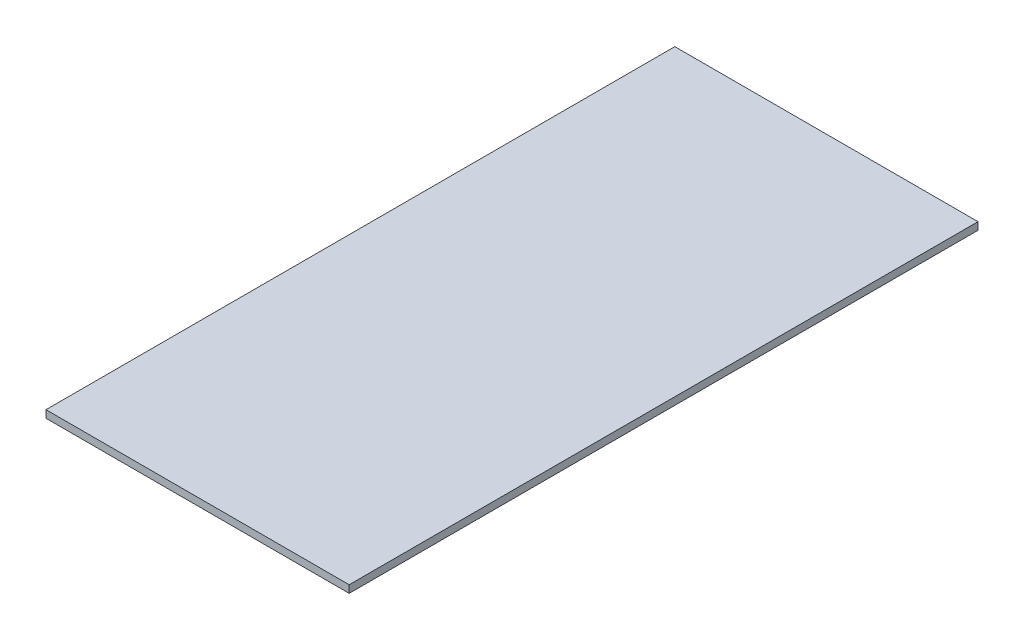
from build123d import *

# Parameters (mm, degrees)
SKETCH1_W           = 514.35
SKETCH1_H           = 1066.8
BOSS_EXTRUDE1_DEPTH = 12.7


with BuildPart() as part:
    # Sketch1 → Boss-Extrude1 (new body)
    with BuildSketch(Plane(origin=(0, 0, 0), x_dir=(1, 0, 0), z_dir=(0, 1, 0))):
        Rectangle(SKETCH1_W, SKETCH1_H)
    extrude(amount=BOSS_EXTRUDE1_DEPTH)


solid = part.part
